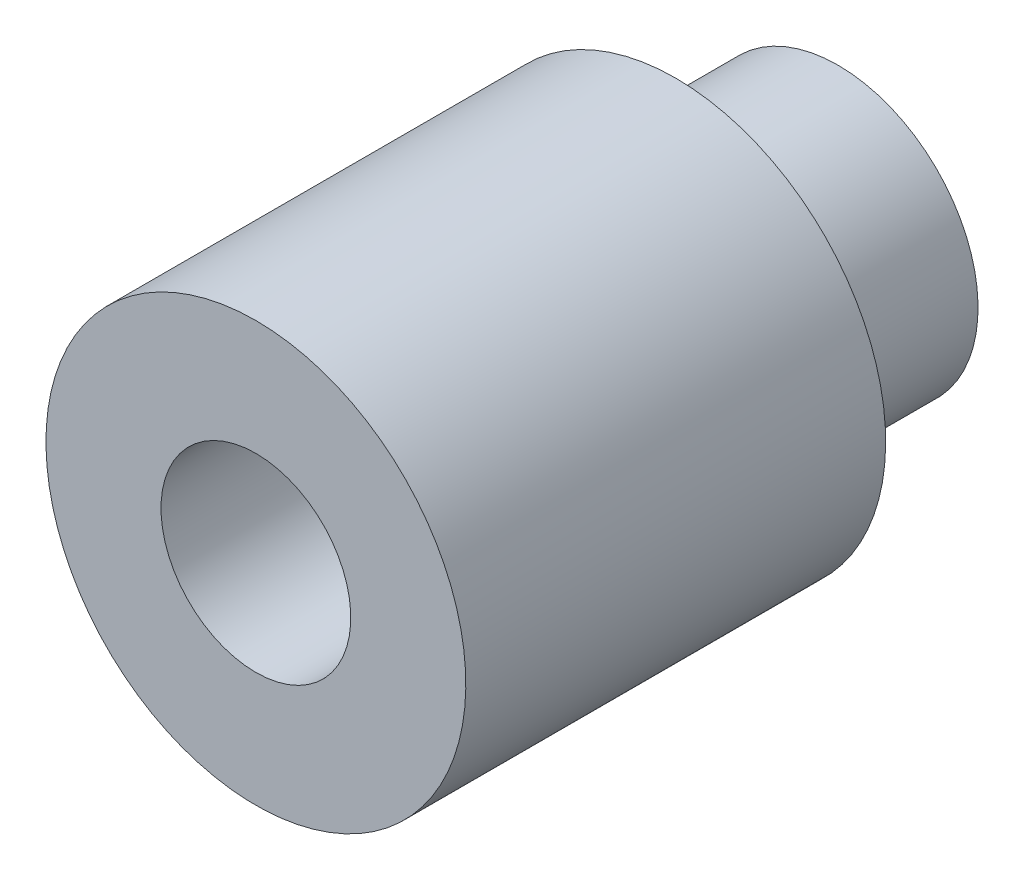
from build123d import *


with BuildPart() as part:
    # Sketch1 → Revolve1 (revolve)
    with BuildSketch(Plane(origin=(0, 0, 0), x_dir=(0, 0, -1), z_dir=(1, 0, 0))):
        Polygon((0, 2.15265), (13.208, 2.15265), (13.208, 3.175), (9.525, 3.175), (9.525, 4.7625), (0, 4.7625), align=None)
    revolve(axis=Axis((0, 0, 0), (0, 0, 1)))


solid = part.part
